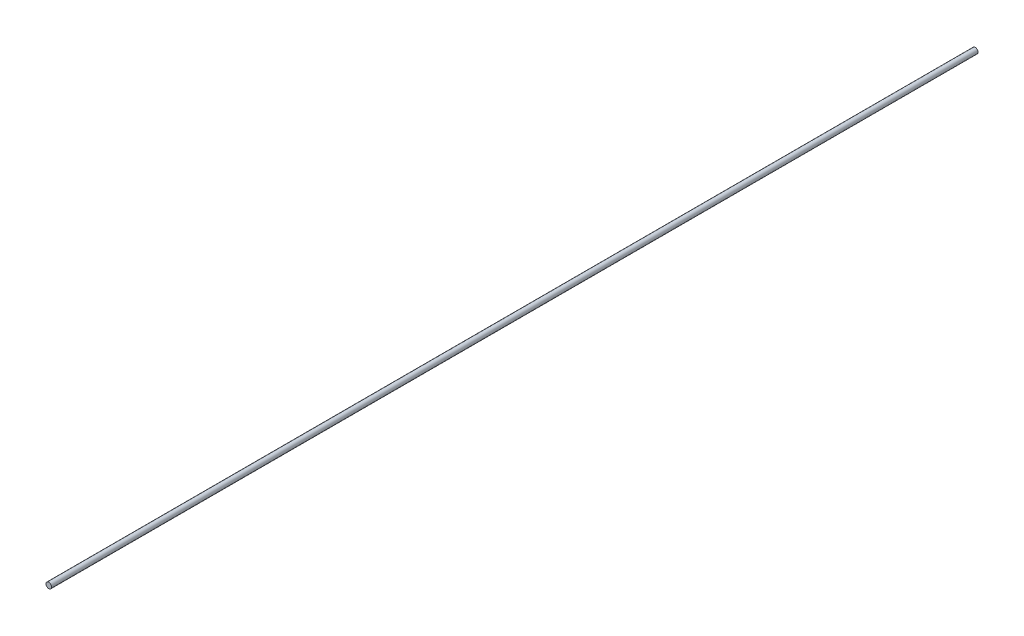
from build123d import *

# Parameters (mm, degrees)
SKETCH1_R           = 0.9
BOSS_EXTRUDE1_DEPTH = 300


with BuildPart() as part:
    # Sketch1 → Boss-Extrude1 (new body)
    with BuildSketch(Plane.XY):
        Circle(SKETCH1_R)
    extrude(amount=BOSS_EXTRUDE1_DEPTH)


solid = part.part
